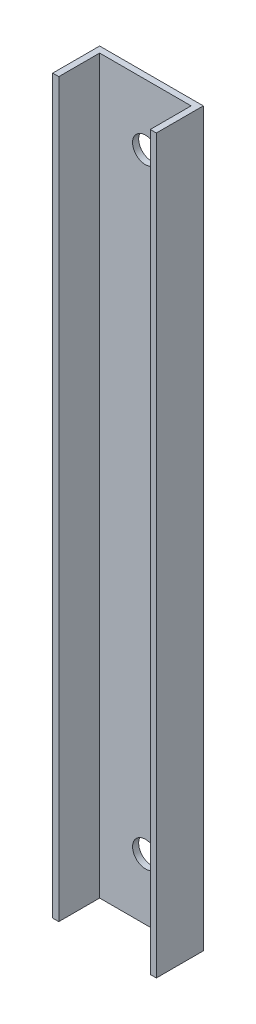
from build123d import *

# Parameters (mm, degrees)
EXTRUDE_THIN1_DEPTH = 120
SKETCH2_R           = 2.1
CUT_EXTRUDE1_DEPTH  = 10


with BuildPart() as part:
    # Sketch1 → Extrude-Thin1 (new body)
    with BuildSketch(Plane(origin=(0, 0, 0), x_dir=(1, 0, 0), z_dir=(0, 1, 0))):
        Polygon((-10.945454545, 0), (-10.945454545, 7.7), (6.054545455, 7.7), (6.054545455, 0), (5.054545455, 0), (5.054545455, 6.7), (-9.945454545, 6.7), (-9.945454545, 0), align=None)
    extrude(amount=EXTRUDE_THIN1_DEPTH)

    # Sketch2 → Cut-Extrude1 (cut)
    with BuildSketch(Plane.XY.offset(-6.7)):
        with Locations((-2.445454545, 110)):
            Circle(SKETCH2_R)
        with Locations(Location((-2.445454545, 10, 0), (0, 0, 180))):
            Circle(SKETCH2_R)
    extrude(amount=-CUT_EXTRUDE1_DEPTH, mode=Mode.SUBTRACT)


solid = part.part
